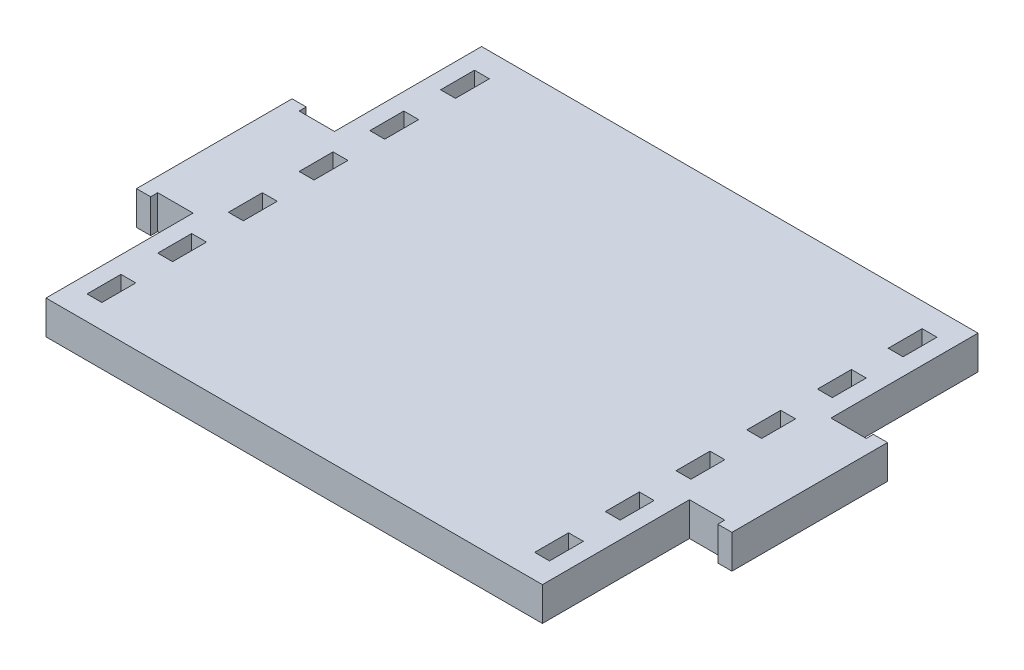
from build123d import *

# Parameters (mm, degrees)
SKETCH1_W           = 6.35
SKETCH1_H           = 25.4
BOSS_EXTRUDE1_DEPTH = 3.0226
SKETCH4_W           = 2.667
SKETCH4_H           = 6.096
CUT_EXTRUDE2_DEPTH  = 6.0452
SKETCH5_W           = 2.54
SKETCH5_H           = 27.94
BOSS_EXTRUDE2_DEPTH = 6.0452


with BuildPart() as part:
    # Sketch1 → Boss-Extrude1 (new, symmetric)
    with BuildSketch(Plane(origin=(0, 0, 0), x_dir=(1, 0, 0), z_dir=(0, 1, 0))):
        Polygon((0, -39.116), (0, 39.116), (-44.577, 39.116), (-44.577, 12.7), (-44.577, -12.7), (-44.577, -39.116), align=None)
        with Locations((-47.752, 0)):
            Rectangle(SKETCH1_W, SKETCH1_H)
        Polygon((44.577, 39.116), (0, 39.116), (0, -39.116), (44.577, -39.116), (44.577, -12.7), (44.577, 12.7), align=None)
        with Locations((47.752, 0)):
            Rectangle(SKETCH1_W, SKETCH1_H)
    extrude(amount=BOSS_EXTRUDE1_DEPTH, both=True)

    # Sketch4 → Cut-Extrude2 (cut)
    with BuildSketch(Plane(origin=(0, 3.0226, 0), x_dir=(1, 0, 0), z_dir=(0, 1, 0))):
        with Locations((-40.1955, -31.75)):
            Rectangle(SKETCH4_W, SKETCH4_H)
        with Locations((-40.1955, -19.05)):
            Rectangle(SKETCH4_W, SKETCH4_H)
        with Locations((-40.1955, -6.35)):
            Rectangle(SKETCH4_W, SKETCH4_H)
        with Locations((-40.1955, 6.35)):
            Rectangle(SKETCH4_W, SKETCH4_H)
        with Locations((-40.1955, 19.05)):
            Rectangle(SKETCH4_W, SKETCH4_H)
        with Locations((-40.1955, 31.75)):
            Rectangle(SKETCH4_W, SKETCH4_H)
        with Locations((40.1955, -19.05)):
            Rectangle(SKETCH4_W, SKETCH4_H)
        with Locations((40.1955, -6.35)):
            Rectangle(SKETCH4_W, SKETCH4_H)
        with Locations((40.1955, 6.35)):
            Rectangle(SKETCH4_W, SKETCH4_H)
        with Locations((40.1955, 19.05)):
            Rectangle(SKETCH4_W, SKETCH4_H)
        with Locations((40.1955, 31.75)):
            Rectangle(SKETCH4_W, SKETCH4_H)
        with Locations((40.1955, -31.75)):
            Rectangle(SKETCH4_W, SKETCH4_H)
    extrude(amount=-CUT_EXTRUDE2_DEPTH, mode=Mode.SUBTRACT)

    # Sketch5 → Boss-Extrude2 (add)
    with BuildSketch(Plane(origin=(0, 3.0226, 0), x_dir=(1, 0, 0), z_dir=(0, 1, 0))):
        with Locations((-52.197, 0)):
            Rectangle(SKETCH5_W, SKETCH5_H)
        with Locations((52.197, 0)):
            Rectangle(SKETCH5_W, SKETCH5_H)
    extrude(amount=-BOSS_EXTRUDE2_DEPTH)


solid = part.part
